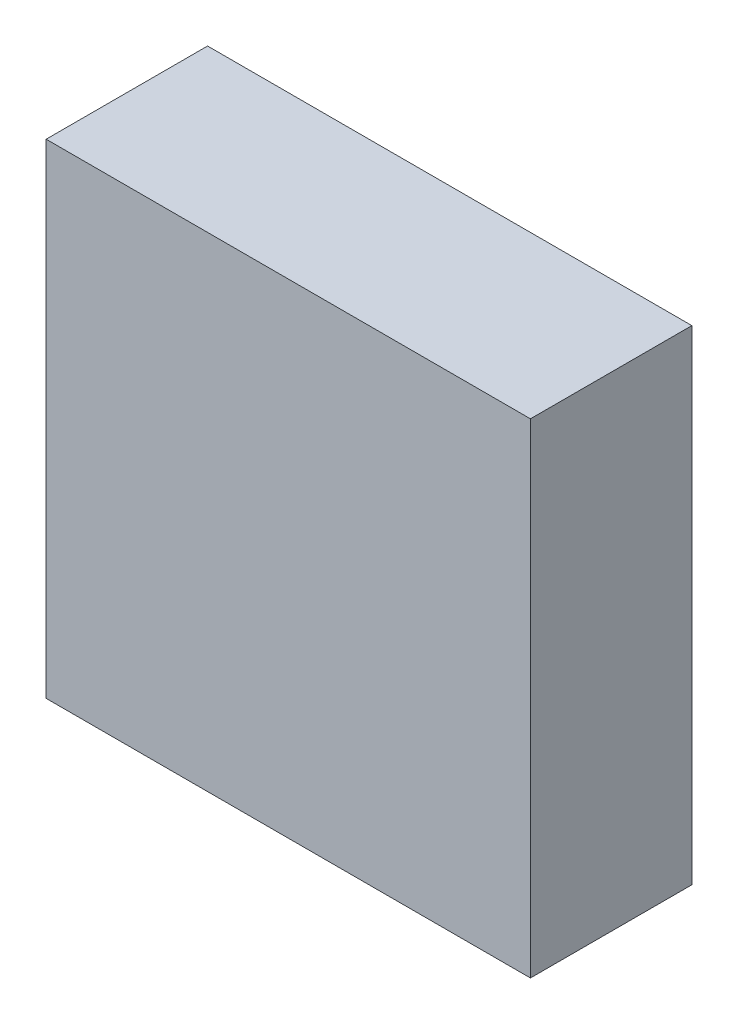
from build123d import *

# Parameters (mm, degrees)
SKETCH1_W           = 3
SKETCH1_H           = 3
BOSS_EXTRUDE1_DEPTH = 1


with BuildPart() as part:
    # Sketch1 → Boss-Extrude1 (new body)
    with BuildSketch(Plane(origin=(0, 0, 0), x_dir=(-1, 0, 0), z_dir=(0, 0, -1))):
        with Locations((-1.059882879, -2.066027462)):
            Rectangle(SKETCH1_W, SKETCH1_H)
    extrude(amount=-BOSS_EXTRUDE1_DEPTH)


solid = part.part
